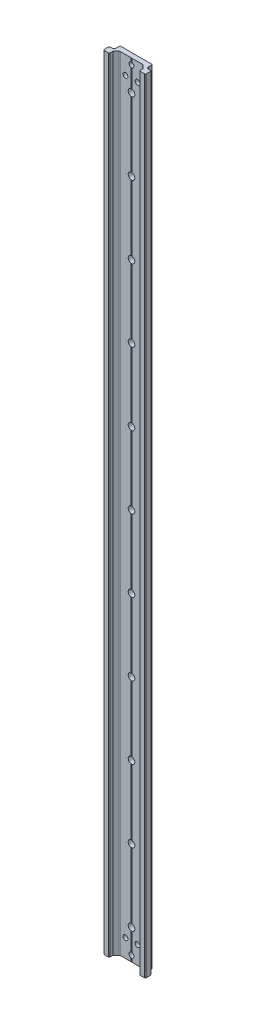
from build123d import *

# Parameters (mm, degrees)
BOSS_EXTRU_1_DEPTH                  = 650
ENL_V_MAT_EXTRU_1_DEPTH             = 651.254758327
ENL_V_MAT_EXTRU_2_DEPTH             = 650
ENL_V_MAT_EXTRU_3_DEPTH             = 651.254758327
ENL_V_MAT_EXTRU_4_DEPTH             = 650
DIAM_TRE_DU_PER_AGE_5_5_5_5_1_D     = 5.5
DIAM_TRE_DU_PER_AGE_5_5_5_5_1_DEPTH = 9.900000103
CHANFREIN1_SIZE2                    = 0.499999975
CHANFREIN1_SIZE                     = 0.5
CHANFREIN2_SIZE                     = 0.3
CHANFREIN3_SIZE2                    = 0.500000028
CHANFREIN3_SIZE                     = 0.499999997
CHANFREIN4_SIZE                     = 0.5
CHANFREIN4_SIZE2                    = 0.500000014
CONG_1_R                            = 1.499999963
CONG_2_R                            = 1.999999944
ESQUISSE8_R                         = 2
ESQUISSE8_R_2                       = 2.093247616
ENL_V_MAT_EXTRU_5_DEPTH             = 10


with BuildPart() as part:
    # Esquisse1 → Boss.-Extru.1 (new body)
    with BuildSketch(Plane(origin=(0, 325, 0), x_dir=(1, 0, 0), z_dir=(0, 1, 0))):
        Polygon((-9.70002034, 1.00000045), (9.70002034, 1.00000045), (12.50002072, -1.79999993), (12.50002072, -4.999999928), (17.50002072, -4.999999928), (17.50002072, 5.000000175), (-17.50002072, 5.000000175), (-17.50002072, -4.999999928), (-12.50002072, -4.999999928), (-12.50002072, -1.79999993), align=None)
    extrude(amount=-BOSS_EXTRU_1_DEPTH)

    # Esquisse2 → Enlèv. mat.-Extru.1 (cut, through all)
    with BuildSketch(Plane.XZ.offset(325)):
        Polygon((-14.30002069, -6.7e-08), (-17.50002072, -6.7e-08), (-17.50002072, -5.000000175), (-13.50002072, -5.000000175), (-13.50002072, -0.799999947), align=None)
    extrude(amount=-ENL_V_MAT_EXTRU_1_DEPTH, mode=Mode.SUBTRACT)

    # Esquisse3 → Enlèv. mat.-Extru.2 (cut)
    with BuildSketch(Plane.XZ.offset(325)):
        Polygon((0.25, -1.000000175), (-0.25, -1.000000175), (1e-09, -1.144337743), align=None)
    extrude(amount=-ENL_V_MAT_EXTRU_2_DEPTH, mode=Mode.SUBTRACT)

    # Esquisse4 → Enlèv. mat.-Extru.3 (cut, through all)
    with BuildSketch(Plane.XZ.offset(325)):
        Polygon((13.50002072, -0.799999925), (13.50002072, -5.000000175), (17.50002072, -5.000000175), (17.50002072, 7.5e-08), (14.30002072, 7.5e-08), align=None)
    extrude(amount=-ENL_V_MAT_EXTRU_3_DEPTH, mode=Mode.SUBTRACT)

    # Esquisse5 → Enlèv. mat.-Extru.4 (cut)
    with BuildSketch(Plane.XZ.offset(325)):
        Polygon((-7.50002072, -5.000000175), (7.50002072, -5.000000175), (7.40002072, -4.900000175), (-7.40002072, -4.900000175), align=None)
    extrude(amount=-ENL_V_MAT_EXTRU_4_DEPTH, mode=Mode.SUBTRACT)

    # Diamètre du perçage Ø5.5 (5.5)1
    with Locations(Plane(origin=(0, 0, -4.900000175), x_dir=(-1, 0, 0), z_dir=(0, 0, -1))):
        with Locations((0, 300), (0, 240), (0, 180), (0, 120), (0, 60), (0, 0), (0, -60), (0, -120), (0, -180), (0, -240), (0, -300)):
            Hole(DIAM_TRE_DU_PER_AGE_5_5_5_5_1_D / 2, depth=DIAM_TRE_DU_PER_AGE_5_5_5_5_1_DEPTH)

    # Chanfrein1
    chanfrein1_edges = [part.edges().sort_by_distance(p)[0] for p in [
        (-17.50002072, 0, 4.999999928),
        (17.50002072, 0, 4.999999928),
    ]]
    chamfer(chanfrein1_edges, length=CHANFREIN1_SIZE, length2=CHANFREIN1_SIZE2)

    # Chanfrein2
    chanfrein2_edges = [part.edges().sort_by_distance(p)[0] for p in [
        (-13.50002072, 0, -5.000000175),
        (13.50002072, 0, -5.000000175),
    ]]
    chamfer(chanfrein2_edges, length=CHANFREIN2_SIZE)

    # Chanfrein3
    chanfrein3_edges = [part.edges().sort_by_distance(p)[0] for p in [
        (-12.50002072, 0, 4.999999928),
        (12.50002072, 0, 4.999999928),
        (-17.50002072, 0, -6.7e-08),
    ]]
    chamfer(chanfrein3_edges, length=CHANFREIN3_SIZE, length2=CHANFREIN3_SIZE2)

    # Chanfrein4
    chanfrein4_edges = [part.edges().sort_by_distance(p)[0] for p in [
        (17.50002072, 0, 7.5e-08),
    ]]
    chanfrein4_side = [part.faces().sort_by_distance(p)[0] for p in [
        (15.90002072, 0, 7.5e-08),
    ]]
    chamfer(chanfrein4_edges, length=CHANFREIN4_SIZE, length2=CHANFREIN4_SIZE2, reference=chanfrein4_side[0])

    # Congé1
    cong_1_edges = [part.edges().sort_by_distance(p)[0] for p in [
        (9.70002034, 0, -1.00000045),
        (-9.70002034, 0, -1.00000045),
    ]]
    fillet(cong_1_edges, radius=CONG_1_R)

    # Congé2
    cong_2_edges = [part.edges().sort_by_distance(p)[0] for p in [
        (-13.50002072, 0, -0.799999947),
        (13.50002072, 0, -0.799999925),
    ]]
    fillet(cong_2_edges, radius=CONG_2_R)

    # Esquisse8 → Enlèv. mat.-Extru.5 (cut)
    with BuildSketch(Plane.XY.offset(-1.00000045)):
        with Locations((-4.999999999, -310)):
            Circle(ESQUISSE8_R)
        with Locations((5.000000001, -310)):
            Circle(ESQUISSE8_R)
        with Locations((-4.999999999, 310)):
            Circle(ESQUISSE8_R)
        with Locations((5.000000001, 310)):
            Circle(ESQUISSE8_R)
        with Locations((0, -320)):
            Circle(ESQUISSE8_R_2)
        with Locations((0, 320)):
            Circle(ESQUISSE8_R)
    extrude(amount=-ENL_V_MAT_EXTRU_5_DEPTH, mode=Mode.SUBTRACT)


solid = part.part
